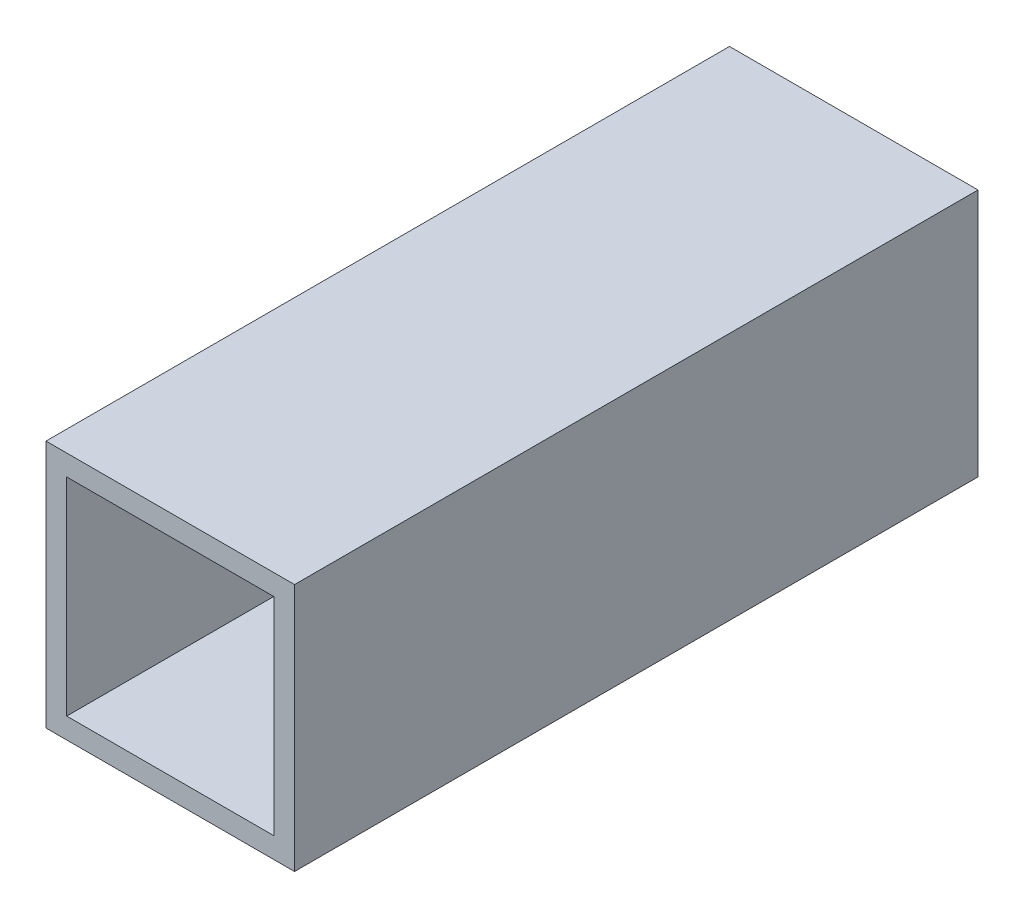
from build123d import *

# Parameters (mm, degrees)
SKETCH_1_W      = 24
SKETCH_1_H      = 24
SKETCH_1_W_2    = 20
SKETCH_1_H_2    = 20
EXTRUDE_1_DEPTH = 33


with BuildPart() as part:
    # 草图1 → 凸台-拉伸1 (new, symmetric)
    with BuildSketch(Plane.XY):
        Rectangle(SKETCH_1_W, SKETCH_1_H)
        Rectangle(SKETCH_1_W_2, SKETCH_1_H_2, mode=Mode.SUBTRACT)
    extrude(amount=EXTRUDE_1_DEPTH, both=True)


solid = part.part
